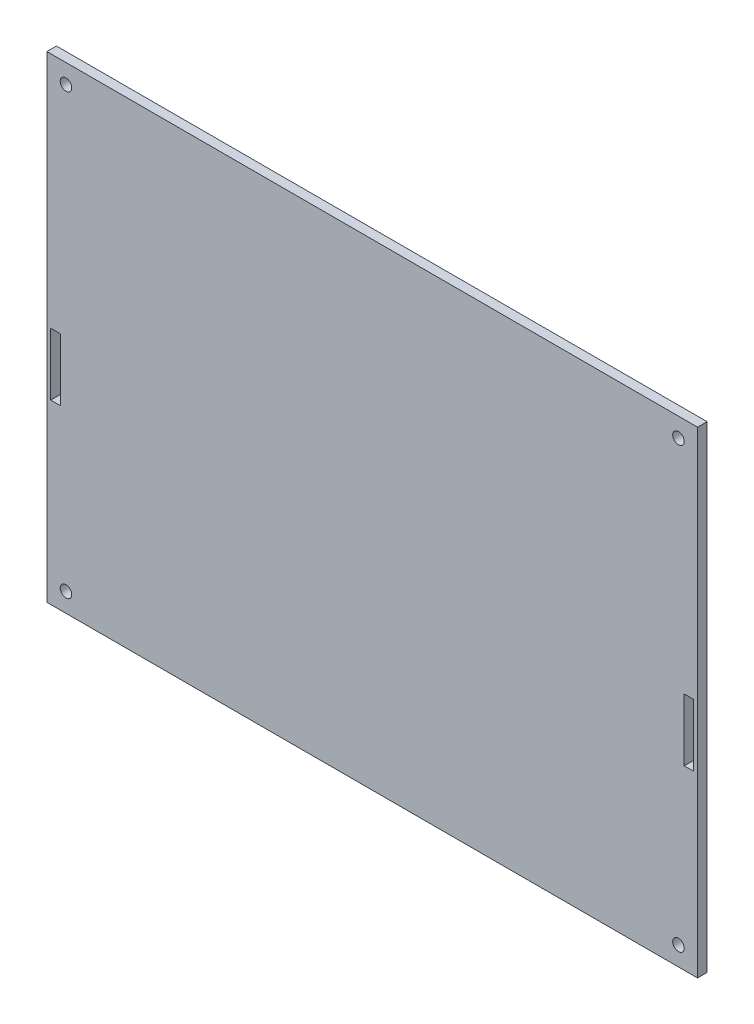
from build123d import *

# Parameters (mm, degrees)
SKETCH1_W           = 341
SKETCH1_H           = 250
SKETCH1_R           = 3.025
SKETCH1_W_2         = 5
SKETCH1_H_2         = 32.605939298
BOSS_EXTRUDE1_DEPTH = 5


with BuildPart() as part:
    # Sketch1 → Boss-Extrude1 (new body)
    with BuildSketch(Plane.XY):
        with Locations((160.5, -115)):
            Rectangle(SKETCH1_W, SKETCH1_H)
        with Locations((0, -230)):
            Circle(SKETCH1_R, mode=Mode.SUBTRACT)
        Circle(SKETCH1_R, mode=Mode.SUBTRACT)
        with Locations((321, 0)):
            Circle(SKETCH1_R, mode=Mode.SUBTRACT)
        with Locations((321, -230)):
            Circle(SKETCH1_R, mode=Mode.SUBTRACT)
        with Locations((-5.5, -130.902969649)):
            Rectangle(SKETCH1_W_2, SKETCH1_H_2, mode=Mode.SUBTRACT)
        with Locations((326.5, -130.902969649)):
            Rectangle(SKETCH1_W_2, SKETCH1_H_2, mode=Mode.SUBTRACT)
    extrude(amount=BOSS_EXTRUDE1_DEPTH)


solid = part.part
